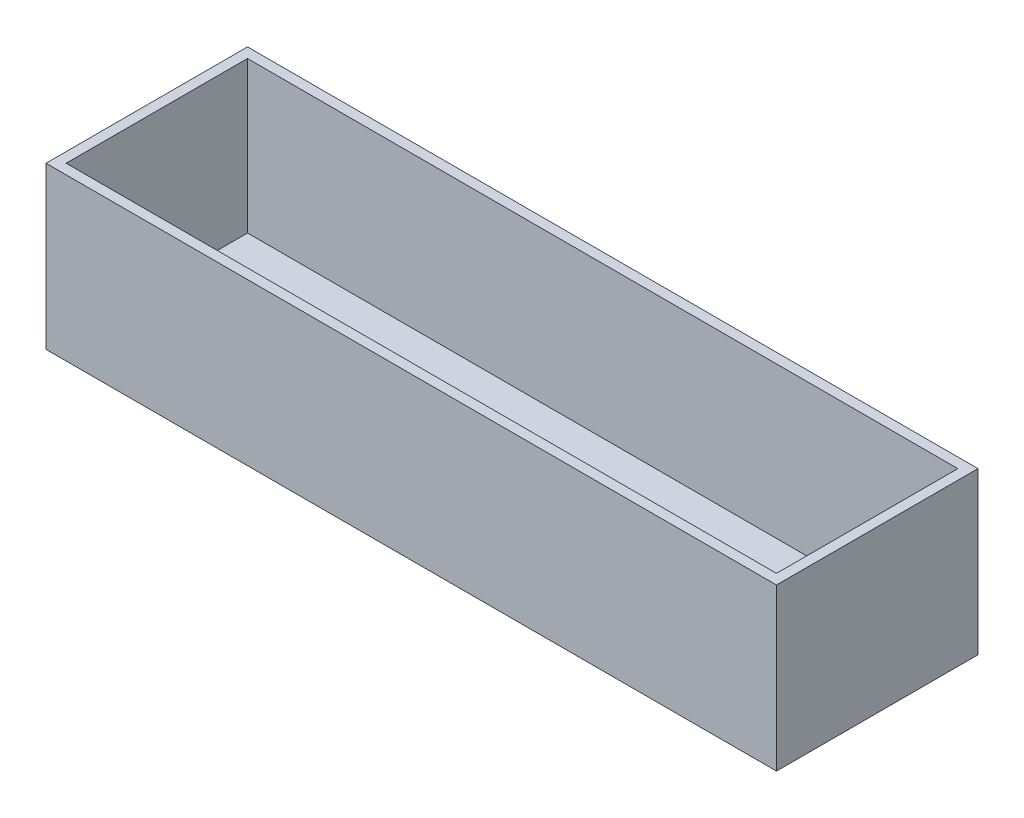
from build123d import *

# Parameters (mm, degrees)
SKETCH1_W           = 145
SKETCH1_H           = 40
SKETCH1_W_2         = 141
SKETCH1_H_2         = 36
BOSS_EXTRUDE1_DEPTH = 30
SKETCH2_W           = 145
SKETCH2_H           = 40
BOSS_EXTRUDE2_DEPTH = 2


with BuildPart() as part:
    # Sketch1 → Boss-Extrude1 (new body)
    with BuildSketch(Plane(origin=(0, 0, 0), x_dir=(1, 0, 0), z_dir=(0, 1, 0))):
        Rectangle(SKETCH1_W, SKETCH1_H)
        Rectangle(SKETCH1_W_2, SKETCH1_H_2, mode=Mode.SUBTRACT)
    extrude(amount=BOSS_EXTRUDE1_DEPTH)

    # Sketch2 → Boss-Extrude2 (add)
    with BuildSketch(Plane.XZ):
        Rectangle(SKETCH2_W, SKETCH2_H)
    extrude(amount=BOSS_EXTRUDE2_DEPTH)


solid = part.part
